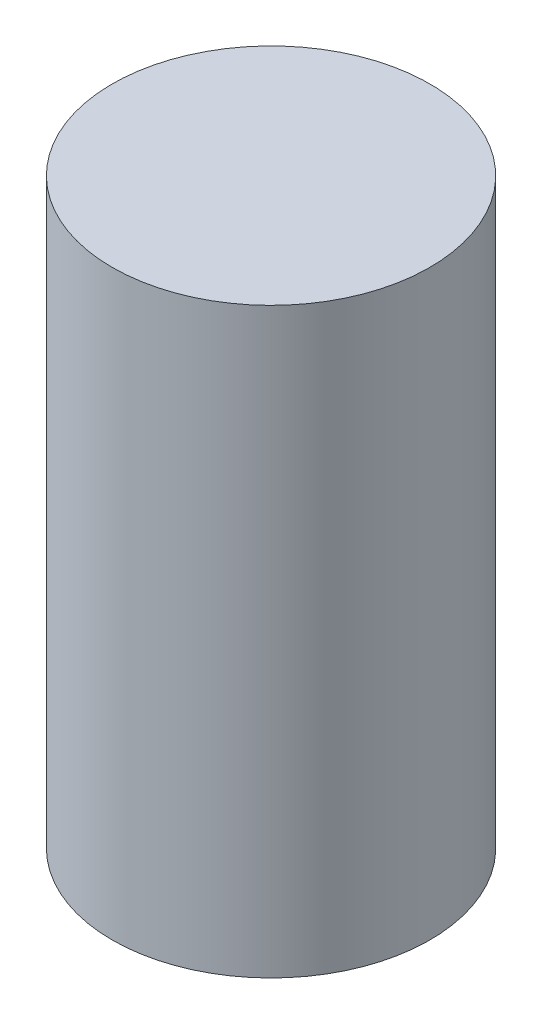
from build123d import *

# Parameters (mm, degrees)
ESQUISSE1_R        = 12
BOSS_EXTRU_1_DEPTH = 44


with BuildPart() as part:
    # Esquisse1 → Boss.-Extru.1 (new body)
    with BuildSketch(Plane(origin=(0, 0, 0), x_dir=(1, 0, 0), z_dir=(0, 1, 0))):
        with Locations(Location((-21.072960424, 7.202151031, 0), (0, 0, 270))):
            Circle(ESQUISSE1_R)
    extrude(amount=BOSS_EXTRU_1_DEPTH)


solid = part.part
